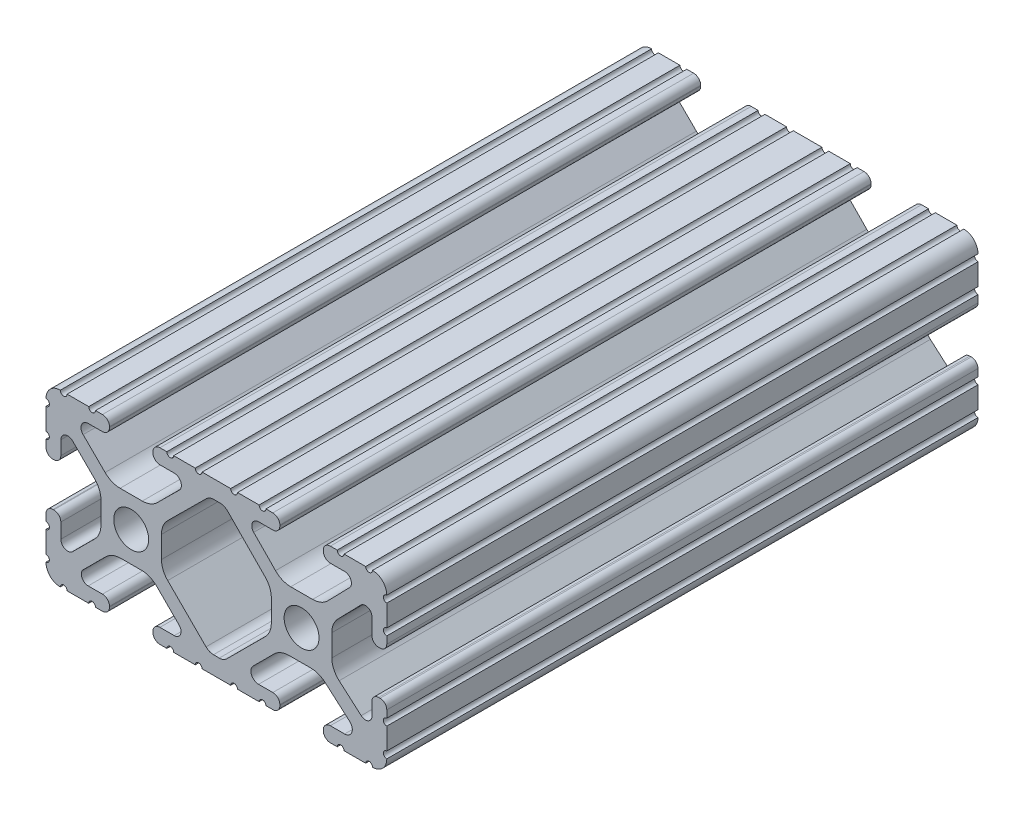
from build123d import *

# Parameters (mm, degrees)
SKETCH1_R           = 2.6035
BOSS_EXTRUDE1_DEPTH = 44.069


with BuildPart() as part:
    # Sketch1 → Boss-Extrude1 (new, symmetric)
    with BuildSketch(Plane.XY):
        with BuildLine():
            Line((18.01710265, 12.7), (16.98745015, 12.7))
            ThreePointArc((16.98745015, 12.7), (16.245730386, 12.392769614), (15.9385, 11.65104985))
            Line((15.9385, 11.65104985), (15.9385, 11.53922))
            ThreePointArc((15.9385, 11.53922), (16.245750844, 10.797450844), (16.98752, 10.4902))
            Line((16.98752, 10.4902), (19.116384363, 10.4902))
            ThreePointArc((19.116384363, 10.4902), (20.052502933, 9.869096983), (19.844087081, 8.765172272))
            Line((19.844087081, 8.765172272), (16.618993479, 5.455112286))
            ThreePointArc((16.618993479, 5.455112286), (15.578994274, 4.745442459), (14.344932584, 4.4958))
            Line((14.344932584, 4.4958), (11.083317835, 4.4958))
            ThreePointArc((11.083317835, 4.4958), (9.854330953, 4.743306833), (8.816955189, 5.447238587))
            Line((8.816955189, 5.447238587), (5.564154119, 8.762652677))
            ThreePointArc((5.564154119, 8.762652677), (5.352591412, 9.867473037), (6.289393385, 10.4902))
            Line((6.289393385, 10.4902), (8.41248, 10.4902))
            ThreePointArc((8.41248, 10.4902), (9.154249156, 10.797450844), (9.4615, 11.53922))
            Line((9.4615, 11.53922), (9.4615, 11.65104985))
            ThreePointArc((9.4615, 11.65104985), (9.154269614, 12.392769614), (8.41254985, 12.7))
            Line((8.41254985, 12.7), (7.38288465, 12.7))
            ThreePointArc((7.38288465, 12.7), (6.87488465, 12.192), (6.36688465, 12.7))
            Line((6.36688465, 12.7), (3.14958095, 12.7))
            ThreePointArc((3.14958095, 12.7), (2.64158095, 12.192), (2.13358095, 12.7))
            Line((2.13358095, 12.7), (-2.13358095, 12.7))
            ThreePointArc((-2.13358095, 12.7), (-2.64158095, 12.192), (-3.14958095, 12.7))
            Line((-3.14958095, 12.7), (-6.36689735, 12.7))
            ThreePointArc((-6.36689735, 12.7), (-6.87489735, 12.192), (-7.38289735, 12.7))
            Line((-7.38289735, 12.7), (-8.41254985, 12.7))
            ThreePointArc((-8.41254985, 12.7), (-9.154269614, 12.392769614), (-9.4615, 11.65104985))
            Line((-9.4615, 11.65104985), (-9.4615, 11.53922))
            ThreePointArc((-9.4615, 11.53922), (-9.154249156, 10.797450844), (-8.41248, 10.4902))
            Line((-8.41248, 10.4902), (-6.283641037, 10.4902))
            ThreePointArc((-6.283641037, 10.4902), (-5.297291557, 9.829633109), (-5.532576693, 8.666071843))
            Line((-5.532576693, 8.666071843), (-8.809985098, 5.416263103))
            ThreePointArc((-8.809985098, 5.416263103), (-9.836720513, 4.734920264), (-11.045536121, 4.4958))
            Line((-11.045536121, 4.4958), (-14.354463879, 4.4958))
            ThreePointArc((-14.354463879, 4.4958), (-15.563279487, 4.734920264), (-16.590014902, 5.416263103))
            Line((-16.590014902, 5.416263103), (-19.867423307, 8.666071843))
            ThreePointArc((-19.867423307, 8.666071843), (-20.102708443, 9.829633109), (-19.116358963, 10.4902))
            Line((-19.116358963, 10.4902), (-16.98752, 10.4902))
            ThreePointArc((-16.98752, 10.4902), (-16.245750844, 10.797450844), (-15.9385, 11.53922))
            Line((-15.9385, 11.53922), (-15.9385, 11.65104985))
            ThreePointArc((-15.9385, 11.65104985), (-16.245730386, 12.392769614), (-16.98745015, 12.7))
            Line((-16.98745015, 12.7), (-18.01711535, 12.7))
            ThreePointArc((-18.01711535, 12.7), (-18.52511535, 12.192), (-19.03311535, 12.7))
            Line((-19.03311535, 12.7), (-22.2504, 12.7))
            ThreePointArc((-22.2504, 12.7), (-22.758323491, 12.192000006), (-23.266399977, 12.699846982))
            ThreePointArc((-23.266399977, 12.699846982), (-24.782522516, 12.082522516), (-25.399846982, 10.566399977))
            ThreePointArc((-25.399846982, 10.566399977), (-24.892000006, 10.058323491), (-25.4, 9.5504))
            Line((-25.4, 9.5504), (-25.4, 6.3330836))
            ThreePointArc((-25.4, 6.3330836), (-24.892, 5.8250836), (-25.4, 5.3170836))
            Line((-25.4, 5.3170836), (-25.4, 4.237520184))
            ThreePointArc((-25.4, 4.237520184), (-25.107393763, 3.531106237), (-24.400979816, 3.2385))
            Line((-24.400979816, 3.2385), (-24.23922, 3.2385))
            ThreePointArc((-24.23922, 3.2385), (-23.497450844, 3.545750844), (-23.1902, 4.28752))
            Line((-23.1902, 4.28752), (-23.1902, 6.334741132))
            ThreePointArc((-23.1902, 6.334741132), (-22.556026952, 7.286023527), (-21.434002553, 7.066535717))
            Line((-21.434002553, 7.066535717), (-18.147950853, 3.808156468))
            ThreePointArc((-18.147950853, 3.808156468), (-17.452759693, 2.774838327), (-17.208501877, 1.553619571))
            Line((-17.208501877, 1.553619571), (-17.208501877, -1.695179196))
            ThreePointArc((-17.208501877, -1.695179196), (-17.450738657, -2.911536421), (-18.140486065, -3.942289578))
            Line((-18.140486065, -3.942289578), (-21.431579576, -7.227386226))
            ThreePointArc((-21.431579576, -7.227386226), (-22.55444896, -7.449940594), (-23.1902, -6.498002195))
            Line((-23.1902, -6.498002195), (-23.1902, -4.28752))
            ThreePointArc((-23.1902, -4.28752), (-23.497450844, -3.545750844), (-24.23922, -3.2385))
            Line((-24.23922, -3.2385), (-24.35098, -3.2385))
            ThreePointArc((-24.35098, -3.2385), (-25.092749156, -3.545750844), (-25.4, -4.28752))
            Line((-25.4, -4.28752), (-25.4, -5.3171344))
            ThreePointArc((-25.4, -5.3171344), (-24.892, -5.8251344), (-25.4, -6.3331344))
            Line((-25.4, -6.3331344), (-25.4, -9.5504))
            ThreePointArc((-25.4, -9.5504), (-24.892000006, -10.058323491), (-25.399846982, -10.566399977))
            ThreePointArc((-25.399846982, -10.566399977), (-24.782522516, -12.082522516), (-23.266399977, -12.699846982))
            ThreePointArc((-23.266399977, -12.699846982), (-22.758323491, -12.192000006), (-22.2504, -12.7))
            Line((-22.2504, -12.7), (-19.03308995, -12.7))
            ThreePointArc((-19.03308995, -12.7), (-18.52508995, -12.192), (-18.01708995, -12.7))
            Line((-18.01708995, -12.7), (-16.9874692, -12.7))
            ThreePointArc((-16.9874692, -12.7), (-16.245700044, -12.392749156), (-15.9384492, -11.65098))
            Line((-15.9384492, -11.65098), (-15.9384492, -11.53922))
            ThreePointArc((-15.9384492, -11.53922), (-16.245700044, -10.797450844), (-16.9874692, -10.4902))
            Line((-16.9874692, -10.4902), (-19.116358963, -10.4902))
            ThreePointArc((-19.116358963, -10.4902), (-20.055197748, -9.862578342), (-19.834124023, -8.755124678))
            Line((-19.834124023, -8.755124678), (-16.49660751, -5.423689618))
            ThreePointArc((-16.49660751, -5.423689618), (-15.467274017, -4.736928798), (-14.253591699, -4.4958))
            Line((-14.253591699, -4.4958), (-11.146408301, -4.4958))
            ThreePointArc((-11.146408301, -4.4958), (-9.932725983, -4.736928798), (-8.90339249, -5.423689618))
            Line((-8.90339249, -5.423689618), (-5.565875977, -8.755124678))
            ThreePointArc((-5.565875977, -8.755124678), (-5.344802252, -9.862578342), (-6.283641037, -10.4902))
            Line((-6.283641037, -10.4902), (-8.4125308, -10.4902))
            ThreePointArc((-8.4125308, -10.4902), (-9.154299956, -10.797450844), (-9.4615508, -11.53922))
            Line((-9.4615508, -11.53922), (-9.4615508, -11.65098))
            ThreePointArc((-9.4615508, -11.65098), (-9.154299956, -12.392749156), (-8.4125308, -12.7))
            Line((-8.4125308, -12.7), (-7.38287195, -12.7))
            ThreePointArc((-7.38287195, -12.7), (-6.87487195, -12.192), (-6.36687195, -12.7))
            Line((-6.36687195, -12.7), (-3.14960635, -12.7))
            ThreePointArc((-3.14960635, -12.7), (-2.64160635, -12.192), (-2.13360635, -12.7))
            Line((-2.13360635, -12.7), (2.13360635, -12.7))
            ThreePointArc((2.13360635, -12.7), (2.64159365, -12.1920127), (3.14958095, -12.7))
            Line((3.14958095, -12.7), (6.36691005, -12.7))
            ThreePointArc((6.36691005, -12.7), (6.87491005, -12.192), (7.38291005, -12.7))
            Line((7.38291005, -12.7), (8.4125308, -12.7))
            ThreePointArc((8.4125308, -12.7), (9.154299956, -12.392749156), (9.4615508, -11.65098))
            Line((9.4615508, -11.65098), (9.4615508, -11.53922))
            ThreePointArc((9.4615508, -11.53922), (9.154299956, -10.797450844), (8.4125308, -10.4902))
            Line((8.4125308, -10.4902), (6.289393385, -10.4902))
            ThreePointArc((6.289393385, -10.4902), (5.231590322, -9.783049717), (5.480677245, -8.535265862))
            Line((5.480677245, -8.535265862), (8.597933595, -5.423689618))
            ThreePointArc((8.597933595, -5.423689618), (9.627267088, -4.736928798), (10.840949406, -4.4958))
            Line((10.840949406, -4.4958), (14.102564155, -4.4958))
            ThreePointArc((14.102564155, -4.4958), (15.215927525, -4.697410182), (16.187895372, -5.276636531))
            Line((16.187895372, -5.276636531), (19.868247549, -8.482246082))
            ThreePointArc((19.868247549, -8.482246082), (20.188435806, -9.746879864), (19.116384363, -10.4902))
            Line((19.116384363, -10.4902), (16.9874692, -10.4902))
            ThreePointArc((16.9874692, -10.4902), (16.245700044, -10.797450844), (15.9384492, -11.53922))
            Line((15.9384492, -11.53922), (15.9384492, -11.65098))
            ThreePointArc((15.9384492, -11.65098), (16.245700044, -12.392749156), (16.9874692, -12.7))
            Line((16.9874692, -12.7), (18.01710265, -12.7))
            ThreePointArc((18.01710265, -12.7), (18.52510265, -12.192), (19.03310265, -12.7))
            Line((19.03310265, -12.7), (22.2504, -12.7))
            ThreePointArc((22.2504, -12.7), (22.758323491, -12.192000006), (23.266399977, -12.699846982))
            ThreePointArc((23.266399977, -12.699846982), (24.782522516, -12.082522516), (25.399846982, -10.566399977))
            ThreePointArc((25.399846982, -10.566399977), (24.892000006, -10.058323492), (25.4, -9.550400001))
            Line((25.4, -9.550400001), (25.4, -6.333083592))
            ThreePointArc((25.4, -6.333083592), (24.892000001, -5.825083593), (25.4, -5.317083593))
            Line((25.4, -5.317083593), (25.4, -4.237520184))
            ThreePointArc((25.4, -4.237520184), (25.107393763, -3.531106237), (24.400979816, -3.2385))
            Line((24.400979816, -3.2385), (24.189220184, -3.2385))
            ThreePointArc((24.189220184, -3.2385), (23.482806237, -3.531106237), (23.1902, -4.237520184))
            Line((23.1902, -4.237520184), (23.1902, -6.155876159))
            ThreePointArc((23.1902, -6.155876159), (22.62232736, -7.038258539), (21.583974541, -6.886926384))
            Line((21.583974541, -6.886926384), (18.29817066, -4.024970844))
            ThreePointArc((18.29817066, -4.024970844), (17.493730985, -2.946044689), (17.208501877, -1.630807374))
            Line((17.208501877, -1.630807374), (17.208501877, 1.630807374))
            ThreePointArc((17.208501877, 1.630807374), (17.442348332, 2.82673414), (18.109440981, 3.846495088))
            Line((18.109440981, 3.846495088), (21.526346532, 7.353420386))
            ThreePointArc((21.526346532, 7.353420386), (22.585896263, 7.574939077), (23.1902, 6.676867167))
            Line((23.1902, 6.676867167), (23.1902, 4.237520184))
            ThreePointArc((23.1902, 4.237520184), (23.482806237, 3.531106237), (24.189220184, 3.2385))
            Line((24.189220184, 3.2385), (24.400979816, 3.2385))
            ThreePointArc((24.400979816, 3.2385), (25.107393763, 3.531106237), (25.4, 4.237520184))
            Line((25.4, 4.237520184), (25.4, 5.3170836))
            ThreePointArc((25.4, 5.3170836), (24.891949193, 5.825134407), (25.4, 6.333185215))
            Line((25.4, 6.333185215), (25.4, 9.550400015))
            ThreePointArc((25.4, 9.550400015), (24.892000013, 10.058323498), (25.399846982, 10.566399977))
            ThreePointArc((25.399846982, 10.566399977), (24.782522516, 12.082522516), (23.266399977, 12.699846982))
            ThreePointArc((23.266399977, 12.699846982), (22.758323491, 12.192000006), (22.2504, 12.7))
            Line((22.2504, 12.7), (19.03310265, 12.7))
            ThreePointArc((19.03310265, 12.7), (18.52510265, 12.192), (18.01710265, 12.7))
        make_face()
        with Locations((-12.7, 0)):
            Circle(SKETCH1_R, mode=Mode.SUBTRACT)
        with Locations((12.7, 0)):
            Circle(SKETCH1_R, mode=Mode.SUBTRACT)
        with BuildLine():
            Line((-7.259513935, -3.869413038), (-1.545748891, -9.572766749))
            ThreePointArc((-1.545748891, -9.572766749), (-1.035199478, -9.913400116), (-0.433213048, -10.033))
            Line((-0.433213048, -10.033), (0.433213048, -10.033))
            ThreePointArc((0.433213048, -10.033), (1.035199478, -9.913400116), (1.545748891, -9.572766749))
            Line((1.545748891, -9.572766749), (7.259513935, -3.869413038))
            ThreePointArc((7.259513935, -3.869413038), (7.949261343, -2.838659881), (8.191498123, -1.622302656))
            Line((8.191498123, -1.622302656), (8.191498123, 1.622302656))
            ThreePointArc((8.191498123, 1.622302656), (7.955573352, 2.823327967), (7.282860769, 3.845864069))
            Line((7.282860769, 3.845864069), (1.675572808, 9.561086461))
            ThreePointArc((1.675572808, 9.561086461), (1.161034429, 9.910236611), (0.551456936, 10.033))
            Line((0.551456936, 10.033), (-0.395199982, 10.033))
            ThreePointArc((-0.395199982, 10.033), (-0.994772524, 9.914396349), (-1.50403329, 9.576450301))
            Line((-1.50403329, 9.576450301), (-7.252049147, 3.876839553))
            ThreePointArc((-7.252049147, 3.876839553), (-7.947240307, 2.843521412), (-8.191498123, 1.622302656))
            Line((-8.191498123, 1.622302656), (-8.191498123, -1.622302656))
            ThreePointArc((-8.191498123, -1.622302656), (-7.949261343, -2.838659881), (-7.259513935, -3.869413038))
        make_face(mode=Mode.SUBTRACT)
    extrude(amount=BOSS_EXTRUDE1_DEPTH, both=True)


solid = part.part
